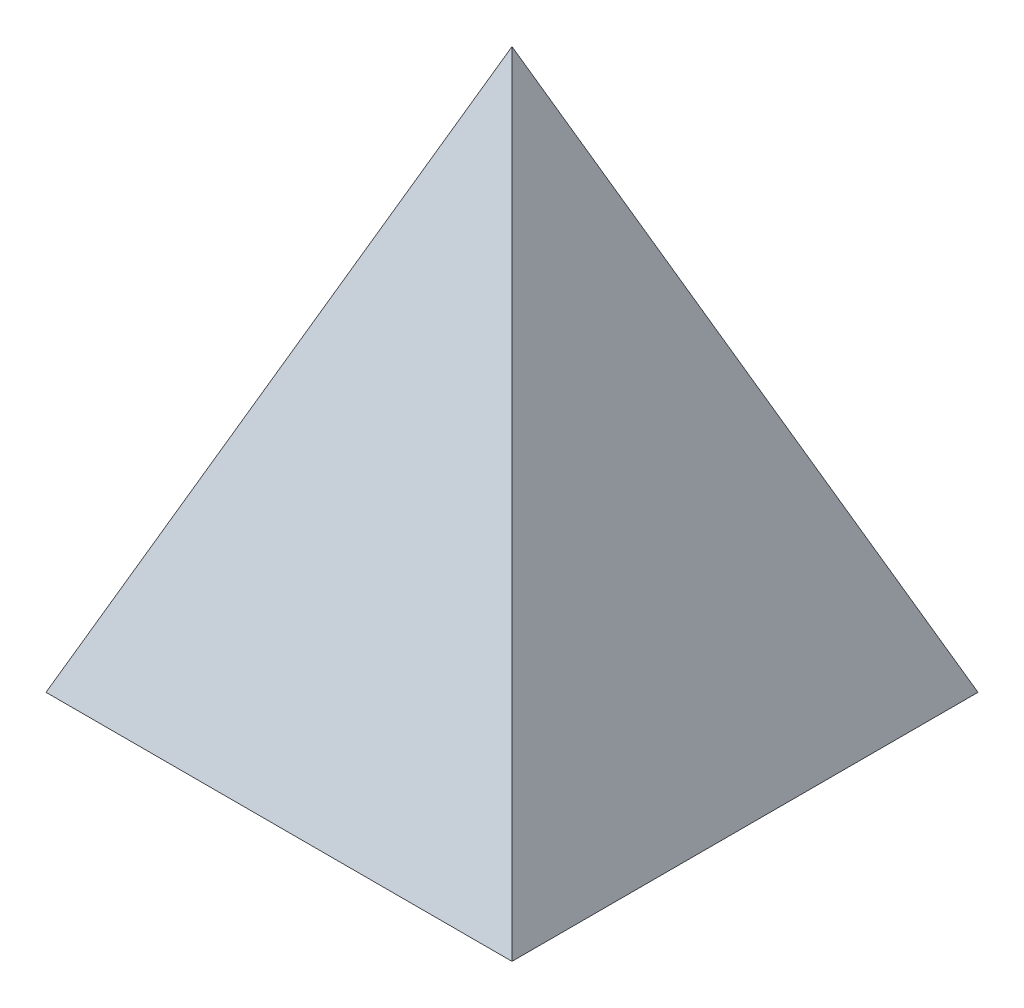
from build123d import *

# Parameters (mm, degrees)
CUNA_DEPTH                        = 50
RECORTE_CARAS_PIRAMIDE_DEPTH      = 140.283882772
RECORTE_CARAS_PIRAMIDE_DEPTH_BACK = 140.283882772
CROQUIS_AGUJEROS_MONTAJE_R        = 4
AGUJERO_INSERTO_M6_DEPTH          = 14


with BuildPart() as part:
    # Croquis_triangulo_frontal → Cuna (new, symmetric)
    with BuildSketch(Plane.XY):
        Polygon((-50, 0), (50, 0), (0, 120), align=None)
    extrude(amount=CUNA_DEPTH, both=True)

    # Croquis_recorte_lateral → Recorte_caras_piramide (cut, two sides: drawn at the far end of the back side and taken through both)
    with BuildSketch(Plane(origin=(0, 0, 0), x_dir=(0, 0, -1), z_dir=(1, 0, 0)).offset(-RECORTE_CARAS_PIRAMIDE_DEPTH_BACK)):
        Polygon((-60, 0), (-50, 0), (0, 120), (50, 0), (60, 0), (60, 130), (-60, 130), align=None)
    extrude(amount=RECORTE_CARAS_PIRAMIDE_DEPTH + RECORTE_CARAS_PIRAMIDE_DEPTH_BACK, mode=Mode.SUBTRACT)

    # Croquis_agujeros_montaje → Agujero_inserto_M6 (cut)
    with BuildSketch(Plane(origin=(0, 0, 0), x_dir=(1, 0, 0), z_dir=(0, 1, 0))):
        with Locations(Location((0, 0, 0), (0, 0, 270))):
            Circle(CROQUIS_AGUJEROS_MONTAJE_R)
    extrude(amount=AGUJERO_INSERTO_M6_DEPTH, mode=Mode.SUBTRACT)


solid = part.part
